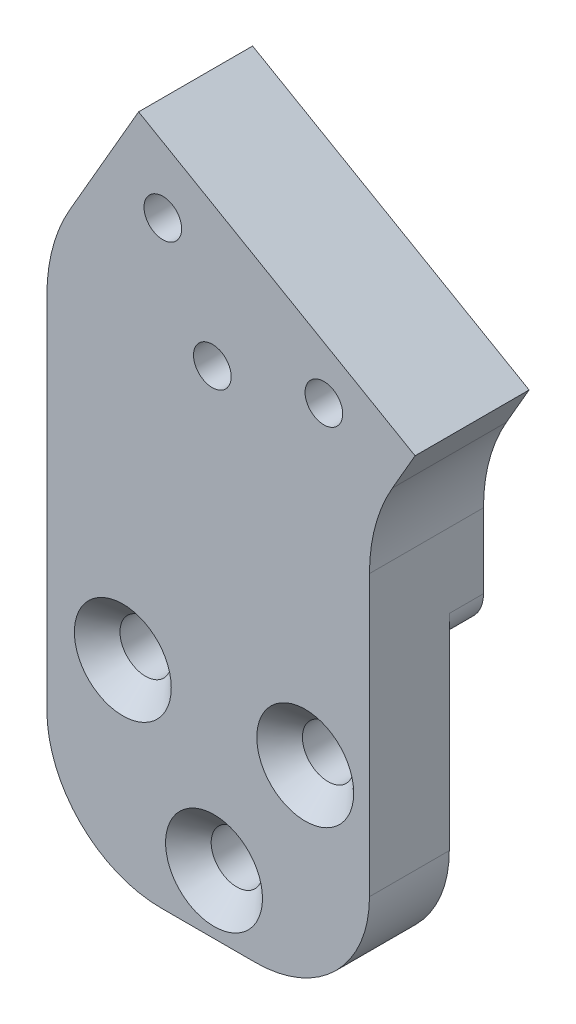
from build123d import *

# Parameters (mm, degrees)
BOSS_EXTRUDE1_DEPTH                                 = 9
BOSS_EXTRUDE1_DEPTH_BACK                            = 1
CUT_EXTRUDE1_DEPTH                                  = 3
CSK_FOR_M4_COUNTERSUNK_FLAT_HEAD_SCREW2_D           = 4.5
CSK_FOR_M4_COUNTERSUNK_FLAT_HEAD_SCREW2_CSINK_D     = 8.5
CSK_FOR_M4_COUNTERSUNK_FLAT_HEAD_SCREW2_CSINK_ANGLE = 90
FILLET1_R                                           = 15
FILLET2_R                                           = 10
FILLET3_R                                           = 3
SKETCH12_R                                          = 1.65
CUT_EXTRUDE2_DEPTH                                  = 181.248579312


with BuildPart() as part:
    # Sketch1 → Boss-Extrude1 (new, two sides: drawn at the far end of the back side and taken through both)
    with BuildSketch(Plane.XY.offset(-BOSS_EXTRUDE1_DEPTH_BACK)):
        Polygon((-14.65789802, 119.616999761), (13.633055873, 119.616999761), (13.633055873, 139.616999761), (13.633055873, 158.176865611), (17.633055873, 165.105068841), (-6.615655433, 179.105068841), (-10.615655433, 172.176865611), (-14.65789802, 165.175496074), (-14.65789802, 158.176865611), (-14.65789802, 139.616999761), align=None)
    extrude(amount=BOSS_EXTRUDE1_DEPTH + BOSS_EXTRUDE1_DEPTH_BACK)

    # Sketch3 → Cut-Extrude1 (cut)
    with BuildSketch(Plane(origin=(0, 0, -1), x_dir=(-1, 0, 0), z_dir=(0, 0, -1))):
        with BuildLine():
            Line((-15, 144.248115566), (-15, 114.785930714))
            Line((-15, 114.785930714), (15, 114.785930714))
            Line((15, 114.785930714), (15, 144.248115566))
            ThreePointArc((15, 144.248115566), (0, 145), (-15, 144.248115566))
        make_face()
    extrude(amount=-CUT_EXTRUDE1_DEPTH, mode=Mode.SUBTRACT)

    # CSK for M4 Countersunk Flat Head Screw2 (through all)
    with Locations(Plane.XY.offset(9)):
        with Locations((0, 0), (8, 136.785930714), (-8, 136.785930714), (0, 124.785930714)):
            CounterSinkHole(CSK_FOR_M4_COUNTERSUNK_FLAT_HEAD_SCREW2_D / 2, CSK_FOR_M4_COUNTERSUNK_FLAT_HEAD_SCREW2_CSINK_D / 2, counter_sink_angle=CSK_FOR_M4_COUNTERSUNK_FLAT_HEAD_SCREW2_CSINK_ANGLE)

    # Fillet1
    fillet1_edges = [part.edges().sort_by_distance(p)[0] for p in [
        (-14.65789802, 165.175496074, 4),
        (13.633055873, 158.176865611, 4),
    ]]
    fillet(fillet1_edges, radius=FILLET1_R)

    # Fillet2
    fillet2_edges = [part.edges().sort_by_distance(p)[0] for p in [
        (13.633055873, 119.616999761, 5.5),
        (-14.65789802, 119.616999761, 5.5),
    ]]
    fillet(fillet2_edges, radius=FILLET2_R)

    # Fillet3
    fillet3_edges = [part.edges().sort_by_distance(p)[0] for p in [
        (-14.65789802, 144.282102161, 0.5),
        (13.633055873, 144.379181239, 0.5),
    ]]
    fillet(fillet3_edges, radius=FILLET3_R)

    # Sketch12 → Cut-Extrude2 (cut, through all)
    with BuildSketch(Plane(origin=(0, 0, -1), x_dir=(-1, 0, 0), z_dir=(0, 0, -1))):
        with Locations((4.49129978, 172.105068841)):
            Circle(SKETCH12_R)
        with Locations((-9.633055873, 165.105068841)):
            Circle(SKETCH12_R)
        with Locations((0.146785414, 163.038543864)):
            Circle(SKETCH12_R)
    extrude(amount=-CUT_EXTRUDE2_DEPTH, mode=Mode.SUBTRACT)


solid = part.part
